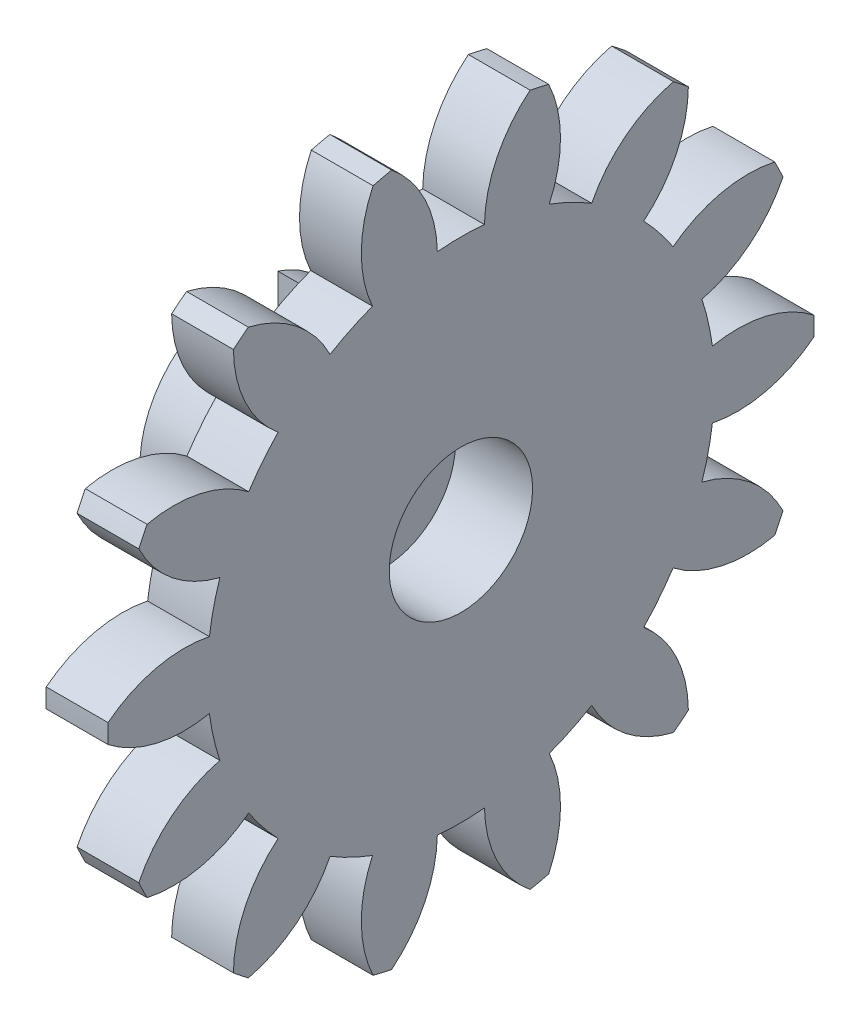
from build123d import *

# Parameters (mm, degrees)
BASPROSKE_W         = 2.8
BASPROSKE_H         = 16
TOOTHCUT_DEPTH      = 23.8
TEETHCUTS_COUNT     = 14
BORSKE_R            = 1.5
BORE_DEPTH          = 50.0000508
SKETCH_2_R          = 4.75
SKETCH_2_R_2        = 1.5
EXTRUDE_1_DEPTH     = 7
SKETCH_3_R          = 3.25
CUT_EXTRUDE_1_DEPTH = 3.5
CHAMFER_1_SIZE      = 1.5
SKETCH_4_W          = 3
SKETCH_4_H          = 9.5
CUT_EXTRUDE_2_DEPTH = 2


with BuildPart() as part:
    # BasProSke → Base-Revolve (revolve)
    with BuildSketch(Plane(origin=(0, 0, 0), x_dir=(1, 0, 0), z_dir=(0, 1, 0)), mode=Mode.PRIVATE) as base_revolve_sk:
        with Locations((1.4, 8)):
            Rectangle(BASPROSKE_W, BASPROSKE_H)
    revolve(base_revolve_sk.sketch.rotate(Axis((-10, 0, 0), (1, 0, 0)), 180), axis=Axis((-10, 0, 0), (1, 0, 0)))

    # TooCutSke → ToothCut (cut, through all)
    with BuildSketch(Plane(origin=(0, 0, 0), x_dir=(0, 0, -1), z_dir=(1, 0, 0))):
        with BuildLine():
            ThreePointArc((1.067858192, 11.449309144), (0, 11.499), (-1.067858192, 11.449309144))
            ThreePointArc((-1.067858192, 11.449309144), (-1.641684211, 13.812780716), (-3.163375005, 15.710076503))
            ThreePointArc((-3.163375005, 15.710076503), (0, 16.0254), (3.163375005, 15.710076503))
            ThreePointArc((3.163375005, 15.710076503), (1.641684211, 13.812780716), (1.067858192, 11.449309144))
        make_face()
    toothcut = extrude(amount=TOOTHCUT_DEPTH, mode=Mode.SUBTRACT)

    # TeethCuts: ToothCut ×14 about axis
    teethcuts_axis = Axis((0, 0, 0), (1, 0, 0))
    for i in range(1, TEETHCUTS_COUNT):
        add(toothcut.rotate(teethcuts_axis, i * 360 / TEETHCUTS_COUNT), mode=Mode.SUBTRACT)

    # BorSke → Bore (cut, symmetric)
    with BuildSketch(Plane(origin=(0, 0, 0), x_dir=(0, 0, -1), z_dir=(1, 0, 0))):
        with Locations(Location((0, 0, 0), (0, 0, 180))):
            Circle(BORSKE_R)
    extrude(amount=BORE_DEPTH, both=True, mode=Mode.SUBTRACT)

    # ｽｹｯﾁ2 → ﾎﾞｽ - 押し出し1 (add)
    with BuildSketch(Plane.ZY):
        with Locations(Location((0, 0, 0), (0, 0, 180))):
            Circle(SKETCH_2_R)
        Circle(SKETCH_2_R_2, mode=Mode.SUBTRACT)
    extrude(amount=EXTRUDE_1_DEPTH)

    # ｽｹｯﾁ3 → ｶｯﾄ - 押し出し1 (cut)
    with BuildSketch(Plane(origin=(2.8, 0, 0), x_dir=(0, 0, -1), z_dir=(1, 0, 0))):
        Circle(SKETCH_3_R)
    extrude(amount=-CUT_EXTRUDE_1_DEPTH, mode=Mode.SUBTRACT)

    # 面取り1
    chamfer_1_edges = [part.edges().sort_by_distance(p)[0] for p in [
        (0, 0, 4.75),
    ]]
    chamfer(chamfer_1_edges, length=CHAMFER_1_SIZE)

    # ｽｹｯﾁ4 → ｶｯﾄ - 押し出し2 (cut)
    with BuildSketch(Plane.ZY.offset(7)):
        Rectangle(SKETCH_4_W, SKETCH_4_H)
    extrude(amount=-CUT_EXTRUDE_2_DEPTH, mode=Mode.SUBTRACT)


solid = part.part
